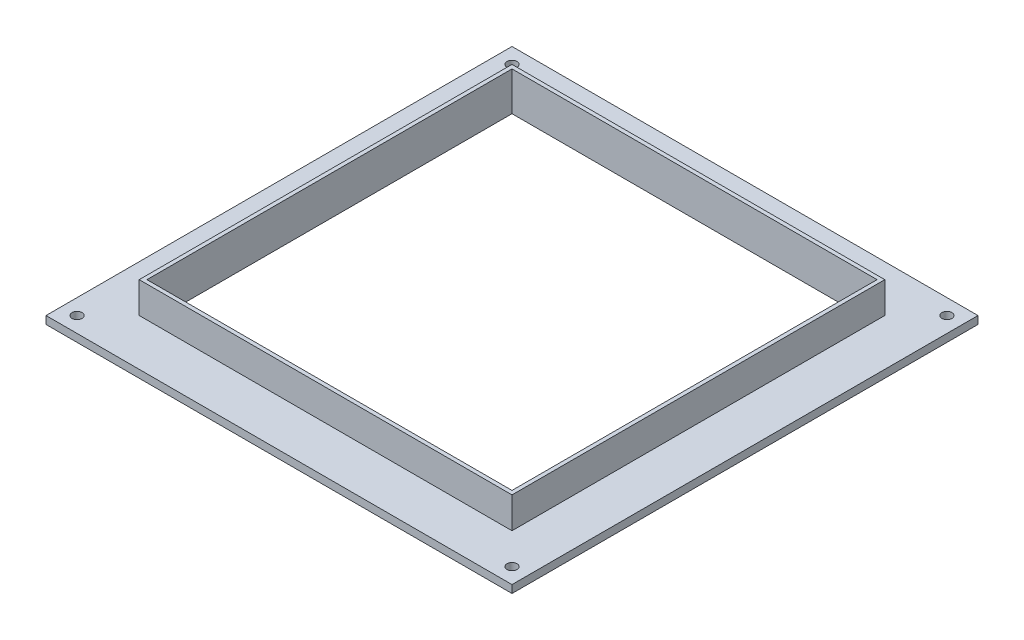
from build123d import *

# Parameters (mm, degrees)
BOSS_EXTRUDE1_DEPTH = 5
SKETCH4_W           = 240
SKETCH4_H           = 240
SKETCH4_W_2         = 230.5
SKETCH4_H_2         = 230.5
BOSS_EXTRUDE2_DEPTH = 20
SKETCH6_R           = 3.25
CUT_EXTRUDE1_DEPTH  = 20
SKETCH7_W           = 240
SKETCH7_H           = 240
CUT_EXTRUDE2_DEPTH  = 20
SKETCH8_W           = 240
SKETCH8_H           = 240
SKETCH8_W_2         = 235
SKETCH8_H_2         = 235
BOSS_EXTRUDE3_DEPTH = 20
SKETCH9_W           = 235
SKETCH9_H           = 235
CUT_EXTRUDE3_DEPTH  = 20


with BuildPart() as part:
    # Sketch3 → Boss-Extrude1 (new body)
    with BuildSketch(Plane(origin=(0, 0, 0), x_dir=(1, 0, 0), z_dir=(0, 1, 0))):
        Polygon((300, 300), (150, 150), (300, 0), align=None)
        Polygon((150, 150), (0, 0), (300, 0), align=None)
        Polygon((0, 300), (0, 0), (150, 150), align=None)
        Polygon((0, 300), (150, 150), (300, 300), align=None)
    extrude(amount=BOSS_EXTRUDE1_DEPTH)

    # Sketch4 → Boss-Extrude2 (add)
    with BuildSketch(Plane(origin=(0, 5, 0), x_dir=(1, 0, 0), z_dir=(0, 1, 0))):
        with Locations((150, 150)):
            Rectangle(SKETCH4_W, SKETCH4_H)
        with Locations((150, 150)):
            Rectangle(SKETCH4_W_2, SKETCH4_H_2, mode=Mode.SUBTRACT)
    extrude(amount=BOSS_EXTRUDE2_DEPTH)

    # Sketch6 → Cut-Extrude1 (cut)
    with BuildSketch(Plane(origin=(0, 5, 0), x_dir=(1, 0, 0), z_dir=(0, 1, 0))):
        with Locations(Location((10, 10, 0), (0, 0, 270))):
            Circle(SKETCH6_R)
        with Locations(Location((290, 10, 0), (0, 0, 270))):
            Circle(SKETCH6_R)
        with Locations(Location((290, 290, 0), (0, 0, 270))):
            Circle(SKETCH6_R)
        with Locations(Location((10, 290, 0), (0, 0, 270))):
            Circle(SKETCH6_R)
    extrude(amount=-CUT_EXTRUDE1_DEPTH, mode=Mode.SUBTRACT)

    # Sketch7 → Cut-Extrude2 (cut)
    with BuildSketch(Plane(origin=(0, 25, 0), x_dir=(1, 0, 0), z_dir=(0, 1, 0))):
        with Locations((150, 150)):
            Rectangle(SKETCH7_W, SKETCH7_H)
    extrude(amount=-CUT_EXTRUDE2_DEPTH, mode=Mode.SUBTRACT)

    # Sketch8 → Boss-Extrude3 (add)
    with BuildSketch(Plane(origin=(0, 5, 0), x_dir=(1, 0, 0), z_dir=(0, 1, 0))):
        with Locations((150, 150)):
            Rectangle(SKETCH8_W, SKETCH8_H)
        with Locations((150, 150)):
            Rectangle(SKETCH8_W_2, SKETCH8_H_2, mode=Mode.SUBTRACT)
    extrude(amount=BOSS_EXTRUDE3_DEPTH)

    # Sketch9 → Cut-Extrude3 (cut)
    with BuildSketch(Plane(origin=(0, 5, 0), x_dir=(1, 0, 0), z_dir=(0, 1, 0))):
        with Locations((150, 150)):
            Rectangle(SKETCH9_W, SKETCH9_H)
    extrude(amount=-CUT_EXTRUDE3_DEPTH, mode=Mode.SUBTRACT)


solid = part.part
